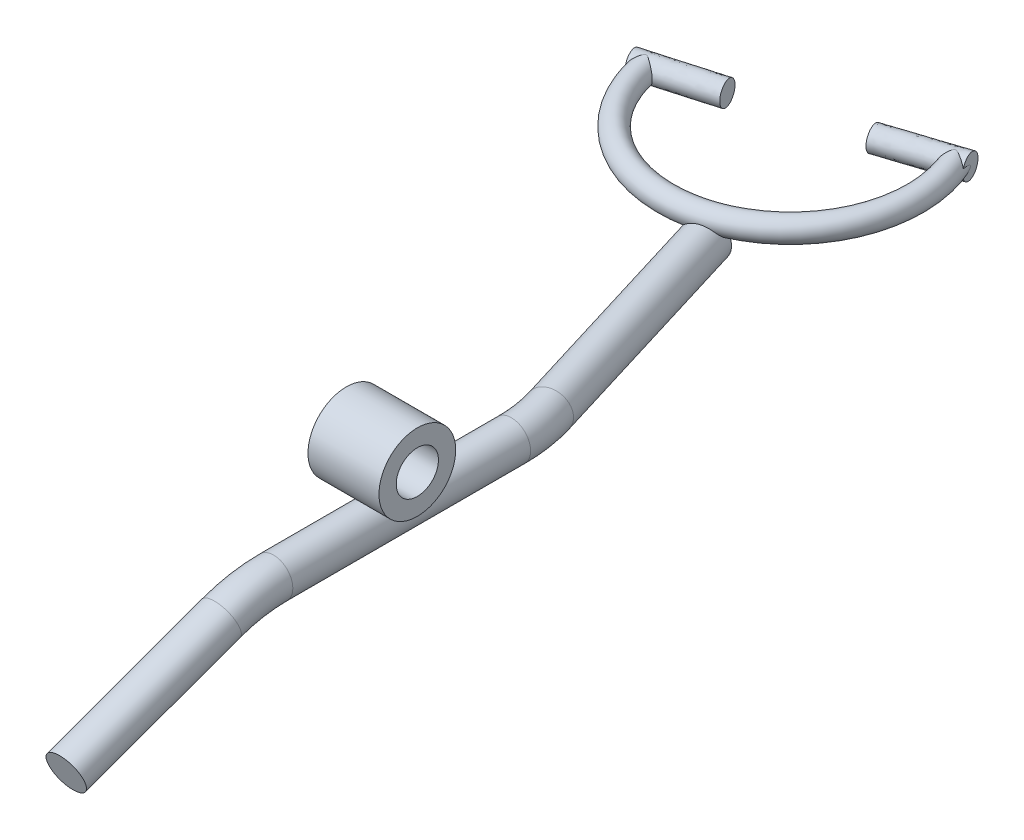
from build123d import *

# Parameters (mm, degrees)
SKETCH_1_R      = 10
SKETCH_1_R_2    = 5.5
EXTRUDE_1_DEPTH = 18.5
SKETCH_4_R      = 5
SKETCH_6_R      = 3
SKETCH_8_R      = 3
SKETCH_10_R     = 3


with BuildPart() as part:
    # Эскиз1 → Бобышка-Вытянуть1 (new body)
    with BuildSketch(Plane(origin=(0, 0, 0), x_dir=(0, 0, -1), z_dir=(1, 0, 0))):
        Circle(SKETCH_1_R)
        Circle(SKETCH_1_R_2, mode=Mode.SUBTRACT)
    extrude(amount=EXTRUDE_1_DEPTH)

    # По траектории1: sweep along a curve in space
    with BuildLine() as sweep_1_path:
        Line((9, -16.912295169, 41.627726505), (9, -31.601007166, 81.984631039))
        ThreePointArc((9, -14.5, 27.946920772), (9, -15.10768988, 34.892847878), (9, -16.912295169, 41.627726505))
        Line((9, -14.5, 27.946920772), (9, -14.5, -34.021959946))
        ThreePointArc((9, -14.5, -34.021959946), (8.560634534, -14.5, -39.934336391), (7.252190239, -14.5, -45.716828135))
        Line((7.252190239, -14.5, -45.716828135), (-10.881275921, -14.5, -105.028723405))
    # Эскиз4 → По траектории1 (sweep)
    with BuildSketch(Plane.XY):
        with Locations((9, -14.5)):
            Circle(SKETCH_4_R)
    sweep(path=sweep_1_path.line)

    # По траектории2: sweep along a path in Эскиз5
    with BuildLine(Plane(origin=(0, -9.5, 0), x_dir=(1, 0, 0), z_dir=(0, 1, 0))) as sweep_2_path:
        ThreePointArc((9.327108594, 149.328764781), (-10.881275921, 105.028723405), (-52.407054726, 130.45473696))
    # Эскиз6 → По траектории2 (sweep)
    with BuildSketch(Plane(origin=(-52.407054726, -9.5, -130.45473696), x_dir=(-0.984679674516163, 0, 0.17437298699839734), z_dir=(-0.17437298699839734, 0, -0.984679674516163))):
        Circle(SKETCH_6_R)
    sweep(path=sweep_2_path.line)

    # По траектории4: sweep along a path in Эскиз7
    with BuildLine(Plane(origin=(0, -9.5, 0), x_dir=(1, 0, 0), z_dir=(0, 1, 0))) as sweep_4_path:
        Line((-6.948042364, 144.352951788), (12.068642346, 150.546957166))
    # Эскиз8 → По траектории4 (sweep)
    with BuildSketch(Plane(origin=(-6.948042364, -9.5, -144.352951788), x_dir=(-0.2923717047227386, 0, -0.9563047559630349), z_dir=(0.9563047559630349, 0, -0.2923717047227386))):
        Circle(SKETCH_8_R)
    sweep(path=sweep_4_path.line)

    # По траектории5: sweep along a path in Эскиз9
    with BuildLine(Plane(origin=(0, -9.5, 0), x_dir=(1, 0, 0), z_dir=(0, 1, 0))) as sweep_5_path:
        Line((-36.131903768, 135.430549953), (-55.36109375, 129.931617999))
    # Эскиз10 → По траектории5 (sweep)
    with BuildSketch(Plane(origin=(-36.131903768, -9.5, -135.430549953), x_dir=(-0.2923717047227386, 0, -0.9563047559630349), z_dir=(0.9563047559630349, 0, -0.2923717047227386))):
        Circle(SKETCH_10_R)
    sweep(path=sweep_5_path.line)


solid = part.part
